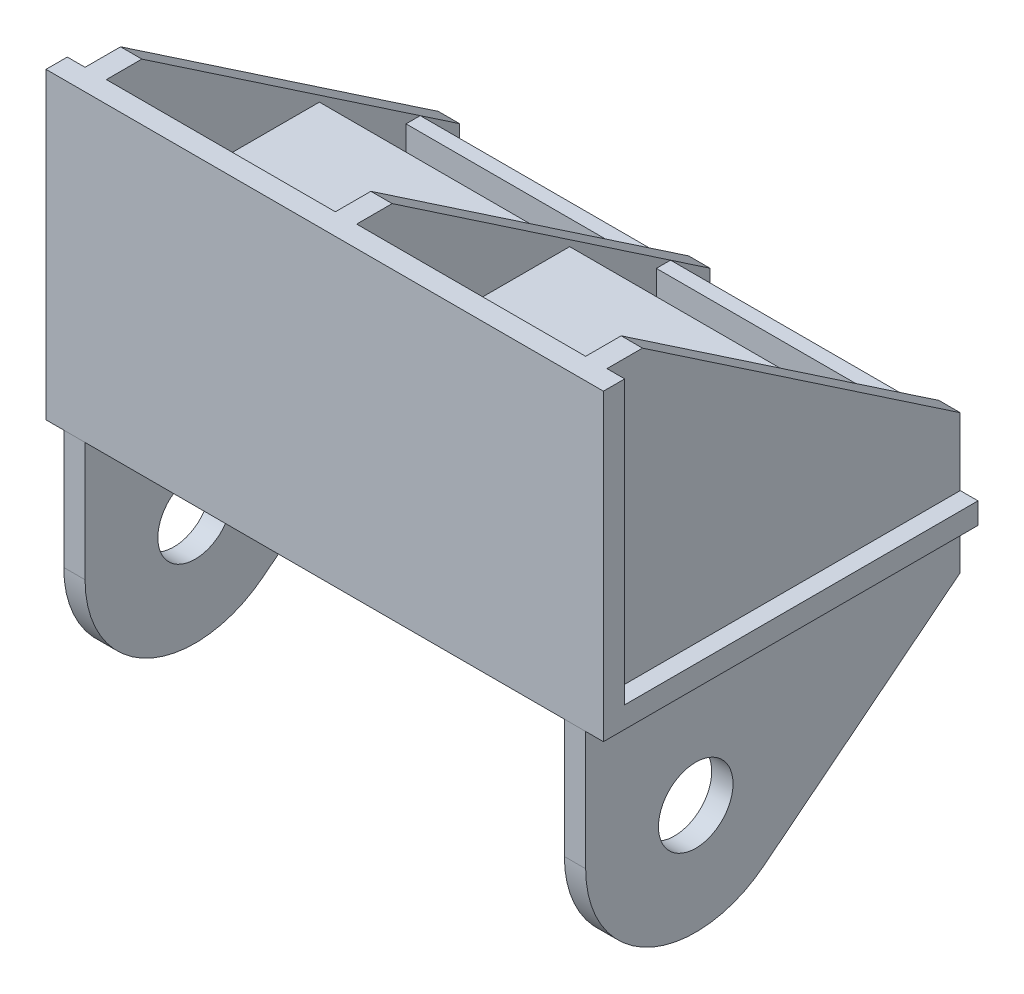
from build123d import *

# Parameters (mm, degrees)
SKETCH_7_W             = 314
SKETCH_7_H             = 211
EXTRUDE_7_DEPTH        = 12
SKETCH_8_W             = 211
SKETCH_8_H             = 150
EXTRUDE_8_DEPTH        = 314
SKETCH_9_R             = 21
CUT_EXTRUDE_1_DEPTH    = 364.629275499
SKETCH_10_W            = 270
SKETCH_10_H            = 211
SKETCH_10_W_2          = 10
CUT_EXTRUDE_2_DEPTH    = 229.954689841
SKETCH_11_W            = 314
SKETCH_11_H            = 12
EXTRUDE_9_DEPTH        = 159
SKETCH_13_W            = 12
SKETCH_13_H            = 199
EXTRUDE_11_DEPTH       = 159
PATTERN_LINEAR_2_COUNT = 2
PATTERN_LINEAR_2_PITCH = 141
PATTERN_LINEAR_3_COUNT = 2
PATTERN_LINEAR_3_PITCH = 141
CUT_EXTRUDE_3_DEPTH    = 373.783113888
SKETCH_15_W            = 8
SKETCH_15_H            = 53
EXTRUDE_12_DEPTH       = 129
SKETCH_16_W            = 129
SKETCH_16_H            = 8
EXTRUDE_13_DEPTH       = 120


with BuildPart() as part:
    # 草图7 → 凸台-拉伸7 (new body)
    with BuildSketch(Plane(origin=(0, 0, 0), x_dir=(1, 0, 0), z_dir=(0, 1, 0))):
        Rectangle(SKETCH_7_W, SKETCH_7_H)
    extrude(amount=EXTRUDE_7_DEPTH)

    # 草图11 → 凸台-拉伸9 (add)
    with BuildSketch(Plane(origin=(0, 12, 0), x_dir=(1, 0, 0), z_dir=(0, 1, 0))):
        with Locations((0, -99.5)):
            Rectangle(SKETCH_11_W, SKETCH_11_H)
    extrude(amount=EXTRUDE_9_DEPTH)

    # 草图13 → 凸台-拉伸11 (add)
    with BuildSketch(Plane(origin=(0, 12, 0), x_dir=(1, 0, 0), z_dir=(0, 1, 0))):
        with Locations((0, 6)):
            Rectangle(SKETCH_13_W, SKETCH_13_H)
    extrude_11 = extrude(amount=EXTRUDE_11_DEPTH)

    # 阵列(线性)2: 凸台-拉伸11 ×2
    with Locations(*[(-i * PATTERN_LINEAR_2_PITCH, 0, 0) for i in range(1, PATTERN_LINEAR_2_COUNT)]):
        add(extrude_11)

    # 阵列(线性)3: 凸台-拉伸11 ×2
    with Locations(*[(i * PATTERN_LINEAR_3_PITCH, 0, 0) for i in range(1, PATTERN_LINEAR_3_COUNT)]):
        add(extrude_11)

    # 草图14 → 切除-拉伸3 (cut, through all)
    with BuildSketch(Plane(origin=(157, 0, 0), x_dir=(0, 0, -1), z_dir=(1, 0, 0))):
        Polygon((-73.5, 171), (105.5, 50), (105.5, 171), align=None)
    extrude(amount=-CUT_EXTRUDE_3_DEPTH, mode=Mode.SUBTRACT)

    # 草图15 → 凸台-拉伸12 (add)
    with BuildSketch(Plane(origin=(-135, 0, 0), x_dir=(0, 0, -1), z_dir=(1, 0, 0))):
        with Locations((79.309917355, 38.5)):
            Rectangle(SKETCH_15_W, SKETCH_15_H)
    extrude_12 = extrude(amount=EXTRUDE_12_DEPTH)

    # 镜向1: 凸台-拉伸12 across plane
    add(extrude_12.mirror(Plane(origin=(0, 0, 0), x_dir=(0, 0, 1), z_dir=(1, 0, 0))))

    # 草图16 → 凸台-拉伸13 (add)
    with BuildSketch(Plane(origin=(0, 0, 93.5), x_dir=(-1, 0, 0), z_dir=(0, 0, -1))):
        with Locations((-70.5, 96)):
            Rectangle(SKETCH_16_W, SKETCH_16_H)
        with Locations((70.5, 96)):
            Rectangle(SKETCH_16_W, SKETCH_16_H)
    extrude(amount=EXTRUDE_13_DEPTH)


with BuildPart() as body_2:
    # 草图8 → 凸台-拉伸8 (new body)
    with BuildSketch(Plane(origin=(157, 0, 0), x_dir=(0, 0, -1), z_dir=(1, 0, 0))):
        with Locations((0, -75)):
            Rectangle(SKETCH_8_W, SKETCH_8_H)
    extrude(amount=-EXTRUDE_8_DEPTH)

    # 草图9 → 切除-拉伸1 (cut, through all)
    with BuildSketch(Plane(origin=(157, 0, 0), x_dir=(0, 0, -1), z_dir=(1, 0, 0))):
        with Locations((-43.5, -67)):
            Circle(SKETCH_9_R)
        with BuildLine():
            Line((105.5, -28), (-4.98434889, -115.585436291))
            ThreePointArc((-4.98434889, -115.585436291), (-70.481749676, -122.821010242), (-105.5, -67))
            Line((-105.5, -67), (-105.5, -150))
            Line((-105.5, -150), (105.5, -150))
            Line((105.5, -150), (105.5, -28))
        make_face()
    extrude(amount=-CUT_EXTRUDE_1_DEPTH, mode=Mode.SUBTRACT)

    # 草图10 → 切除-拉伸2 (cut, through all)
    with BuildSketch(Plane(origin=(0, 0, 0), x_dir=(1, 0, 0), z_dir=(0, 1, 0))):
        Rectangle(SKETCH_10_W, SKETCH_10_H)
        with Locations((-152, 0)):
            Rectangle(SKETCH_10_W_2, SKETCH_10_H)
        with Locations((152, 0)):
            Rectangle(SKETCH_10_W_2, SKETCH_10_H)
    extrude(amount=-CUT_EXTRUDE_2_DEPTH, mode=Mode.SUBTRACT)


with BuildPart() as cut_extrude_2_piece_1:
    # of the separate pieces the step leaves, piece 1, a body of its own (cut_extrude_2_pieces)
    add(body_2.part.solids().sort_by_distance((147, 0, 105.5))[0])


with BuildPart() as cut_extrude_2_piece_2:
    # of the separate pieces the step leaves, piece 2, a body of its own (cut_extrude_2_pieces)
    add(body_2.part.solids().sort_by_distance((-135, 0, 105.5))[0])


solid = Compound([part.part, cut_extrude_2_piece_1.part, cut_extrude_2_piece_2.part])
